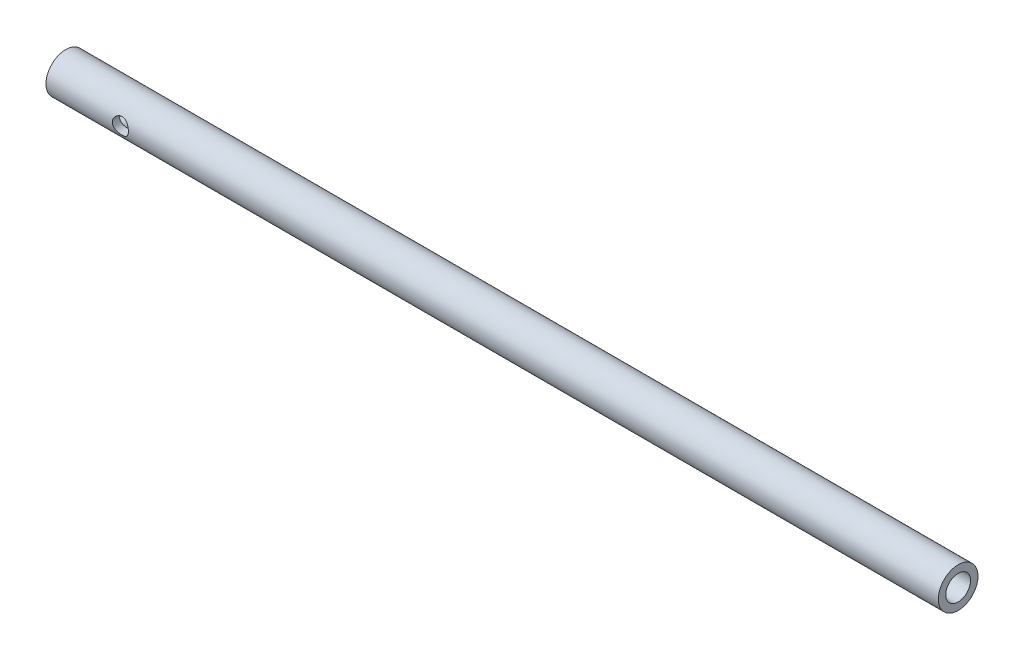
from build123d import *

# Parameters (mm, degrees)
SKETCH1_R           = 16
SKETCH1_R_2         = 10
BOSS_EXTRUDE1_DEPTH = 720
SKETCH2_R           = 6.5
CUT_EXTRUDE1_DEPTH  = 29.5


with BuildPart() as part:
    # Sketch1 → Boss-Extrude1 (new body)
    with BuildSketch(Plane(origin=(0, 0, 0), x_dir=(0, 0, -1), z_dir=(1, 0, 0))):
        Circle(SKETCH1_R)
        Circle(SKETCH1_R_2, mode=Mode.SUBTRACT)
    extrude(amount=-BOSS_EXTRUDE1_DEPTH)

    # Sketch2 → Cut-Extrude1 (cut, symmetric)
    with BuildSketch(Plane.XY):
        with Locations((-660, 0)):
            Circle(SKETCH2_R)
    extrude(amount=CUT_EXTRUDE1_DEPTH, both=True, mode=Mode.SUBTRACT)


solid = part.part
